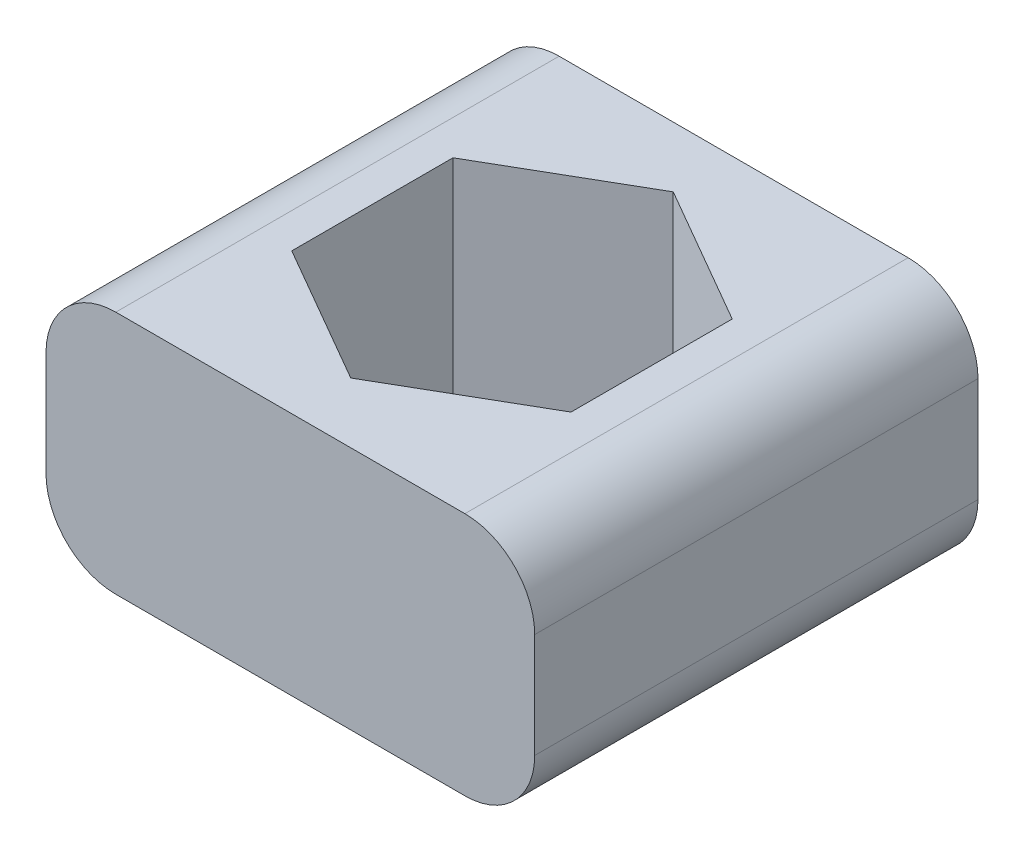
from build123d import *

# Parameters (mm, degrees)
SKETCH1_W            = 14
SKETCH1_H            = 7
BOSS_EXTRUDE1_DEPTH  = 6.35
CUT_EXTRUDE1_DEPTH   = 6
FILLET1_R            = 2
M5_CLEARANCE_HOLE1_D = 5.3


with BuildPart() as part:
    # Sketch1 → Boss-Extrude1 (new, symmetric)
    with BuildSketch(Plane.XY):
        with Locations((0, -3.5)):
            Rectangle(SKETCH1_W, SKETCH1_H)
    extrude(amount=BOSS_EXTRUDE1_DEPTH, both=True)

    # Sketch2 → Cut-Extrude1 (cut)
    with BuildSketch(Plane(origin=(0, 0, 0), x_dir=(1, 0, 0), z_dir=(0, 1, 0))):
        Polygon((0, -4.618802154), (4, -2.309401077), (4, 2.309401077), (0, 4.618802154), (-4, 2.309401077), (-4, -2.309401077), align=None)
    extrude(amount=-CUT_EXTRUDE1_DEPTH, mode=Mode.SUBTRACT)

    # Fillet1
    fillet1_edges = [part.edges().sort_by_distance(p)[0] for p in [
        (7, -7, 0),
        (-7, -7, 0),
        (-7, 0, 0),
        (7, 0, 0),
    ]]
    fillet(fillet1_edges, radius=FILLET1_R)

    # M5 Clearance Hole1 (through all)
    with Locations(Plane(origin=(0, -7, 0), x_dir=(-1, 0, 0), z_dir=(0, -1, 0))):
        with Locations((0, 0)):
            Hole(M5_CLEARANCE_HOLE1_D / 2)


solid = part.part
